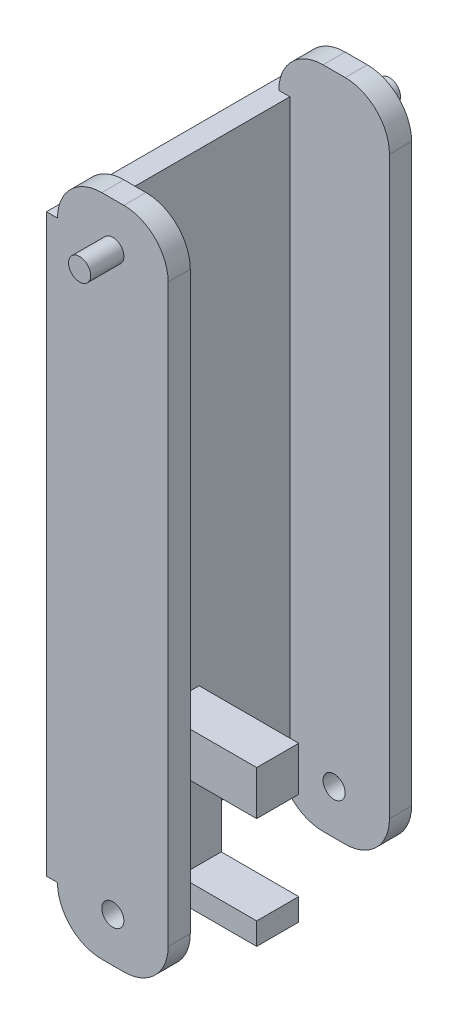
from build123d import *

# Parameters (mm, degrees)
SKETCH1_R           = 5
BOSS_EXTRUDE1_DEPTH = 10
SKETCH2_R           = 5
BOSS_EXTRUDE2_DEPTH = 15
SKETCH3_W           = 5
SKETCH3_H           = 260
BOSS_EXTRUDE3_DEPTH = 45
SKETCH8_W           = 5
SKETCH8_H           = 19
BOSS_EXTRUDE4_DEPTH = 20
SKETCH9_W           = 19
SKETCH9_H           = 10
SKETCH9_H_2         = 20
BOSS_EXTRUDE5_DEPTH = 45
SKETCH10_W          = 19
SKETCH10_H          = 40
BOSS_EXTRUDE6_DEPTH = 10
BOSS_EXTRUDE7_DEPTH = 5


with BuildPart() as part:
    # Sketch1 → Boss-Extrude1 (new body)
    with BuildSketch(Plane.XY):
        with BuildLine():
            Line((-5, -20), (5, -20))
            ThreePointArc((5, -20), (19.142135624, -14.142135624), (25, 0))
            Line((25, 0), (25, 260))
            ThreePointArc((25, 260), (19.142135624, 274.142135624), (5, 280))
            Line((5, 280), (-5, 280))
            ThreePointArc((-5, 280), (-19.142135624, 274.142135624), (-25, 260))
            Line((-25, 260), (-25, 0))
            ThreePointArc((-25, 0), (-19.142135624, -14.142135624), (-5, -20))
        make_face()
        Circle(SKETCH1_R, mode=Mode.SUBTRACT)
    boss_extrude1 = extrude(amount=BOSS_EXTRUDE1_DEPTH)

    # Sketch2 → Boss-Extrude2 (add)
    with BuildSketch(Plane.XY.offset(10)):
        with Locations((0, 260)):
            Circle(SKETCH2_R)
    boss_extrude2 = extrude(amount=BOSS_EXTRUDE2_DEPTH)

    # Sketch3 → Boss-Extrude3 (add)
    with BuildSketch(Plane(origin=(0, 0, 0), x_dir=(-1, 0, 0), z_dir=(0, 0, -1))):
        with Locations((22.5, 130)):
            Rectangle(SKETCH3_W, SKETCH3_H)
    boss_extrude3 = extrude(amount=BOSS_EXTRUDE3_DEPTH)

    # Mirror1: Boss-Extrude1, Boss-Extrude2, Boss-Extrude3 across plane
    add(boss_extrude1.mirror(Plane.XY.offset(-45)))
    add(boss_extrude2.mirror(Plane.XY.offset(-45)))
    add(boss_extrude3.mirror(Plane.XY.offset(-45)))

    # Sketch8 → Boss-Extrude4 (add)
    with BuildSketch(Plane.XZ):
        with Locations((-22.5, -39.5)):
            Rectangle(SKETCH8_W, SKETCH8_H)
    extrude(amount=BOSS_EXTRUDE4_DEPTH)

    # Sketch9 → Boss-Extrude5 (add)
    with BuildSketch(Plane(origin=(-20, 0, 0), x_dir=(0, 0, -1), z_dir=(1, 0, 0))):
        with Locations((39.5, -15)):
            Rectangle(SKETCH9_W, SKETCH9_H)
        with Locations((39.5, 40)):
            Rectangle(SKETCH9_W, SKETCH9_H_2)
    extrude(amount=BOSS_EXTRUDE5_DEPTH)

    # Sketch10 → Boss-Extrude6 (add)
    with BuildSketch(Plane(origin=(-20, 0, 0), x_dir=(0, 0, -1), z_dir=(1, 0, 0))):
        with Locations((39.5, 10)):
            Rectangle(SKETCH10_W, SKETCH10_H)
    extrude(amount=BOSS_EXTRUDE6_DEPTH)

    # Sketch11 → Boss-Extrude7 (add)
    with BuildSketch(Plane.ZY.offset(25)):
        Polygon((10, 0), (-30, 0), (-30, -20), (-49, -20), (-49, 0), (-100, 0), (-100, 260), (10, 260), align=None)
    extrude(amount=BOSS_EXTRUDE7_DEPTH)


solid = part.part
